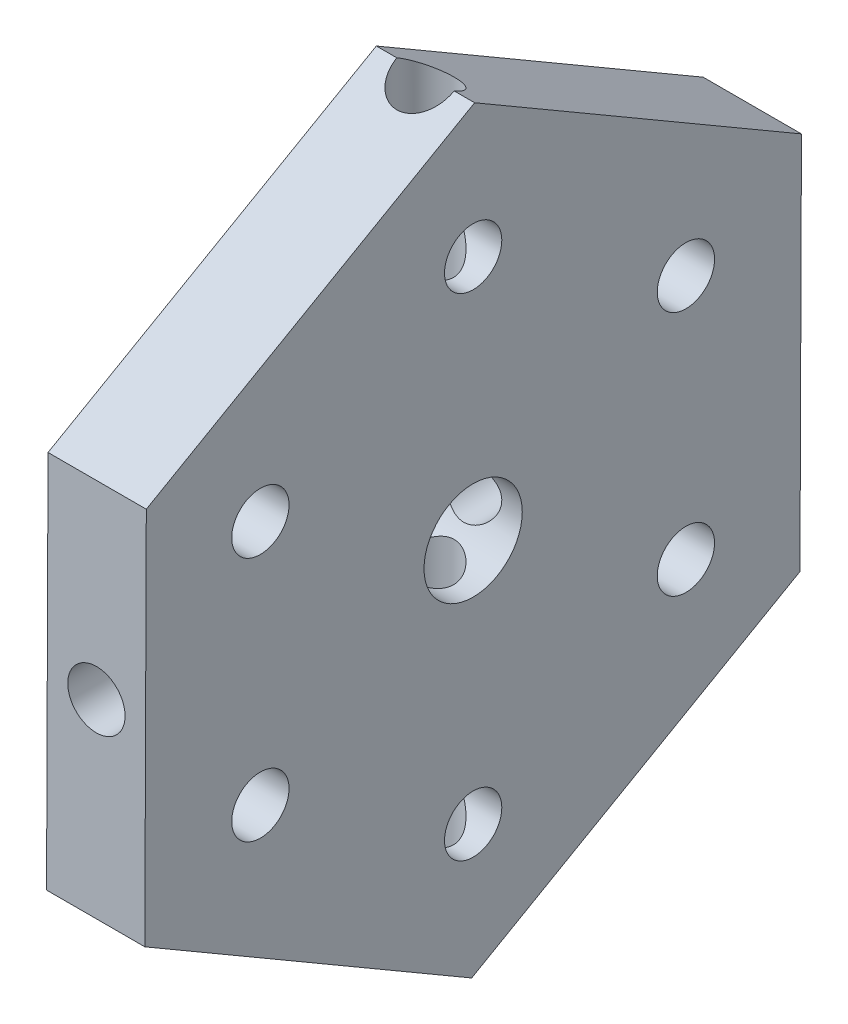
from build123d import *
from build123d.topology import SkipClean

# Parameters (mm, degrees)
ESQUISSE1_R                  = 3
ESQUISSE1_R_2                = 1.75
BOSS_EXTRU_1_DEPTH           = 6
BOSS_EXTRU_2_START           = 6
ESQUISSE2_R                  = 10
ESQUISSE2_R_2                = 3
BOSS_EXTRU_2_DEPTH           = 6
ENL_V_MAT_EXTRU_1_DEPTH      = 32.163011471
ENL_V_MAT_EXTRU_1_DEPTH_BACK = 32.163011471
ESQUISSE3_R                  = 1.75
ESQUISSE4_R                  = 1.75
ENL_V_MAT_EXTRU_2_DEPTH      = 47.653593371


with BuildPart() as part:
    # Esquisse1 → Boss.-Extru.1 (new body)
    with BuildSketch(Plane(origin=(0, 0, 0), x_dir=(0, 0, -1), z_dir=(1, 0, 0))):
        Polygon((-20.045153068, -11.468442431), (-0.090614047, -23.093832996), (19.954539021, -11.625390564), (20.045153068, 11.468442431), (0.090614047, 23.093832996), (-19.954539021, 11.625390564), align=None)
        Circle(ESQUISSE1_R, mode=Mode.SUBTRACT)
        with Locations((0, 15)):
            Circle(ESQUISSE1_R_2, mode=Mode.SUBTRACT)
        with Locations((12.990381057, 7.5)):
            Circle(ESQUISSE1_R_2, mode=Mode.SUBTRACT)
        with Locations((12.990381057, -7.5)):
            Circle(ESQUISSE1_R_2, mode=Mode.SUBTRACT)
        with Locations((0, -15)):
            Circle(ESQUISSE1_R_2, mode=Mode.SUBTRACT)
        with Locations((-12.990381057, -7.5)):
            Circle(ESQUISSE1_R_2, mode=Mode.SUBTRACT)
        with Locations((-12.990381057, 7.5)):
            Circle(ESQUISSE1_R_2, mode=Mode.SUBTRACT)
    extrude(amount=BOSS_EXTRU_1_DEPTH)

    # Esquisse2 → Boss.-Extru.2 (add)
    with SkipClean():  # the faces are left unmerged after this step: merging them gives an invalid solid
        with BuildSketch(Plane.ZY.offset(BOSS_EXTRU_2_START)):
            with Locations(Location((0, 0, 0), (0, 0, 180))):
                Circle(ESQUISSE2_R)
            Circle(ESQUISSE2_R_2, mode=Mode.SUBTRACT)
        extrude(amount=-BOSS_EXTRU_2_DEPTH)

    # Esquisse3 → Enlèv. mat.-Extru.1 (cut, two sides: drawn at the far end of the back side and taken through both)
    with SkipClean():  # the faces are left unmerged after this step: merging them gives an invalid solid
        with BuildSketch(Plane(origin=(0, 0, 0), x_dir=(1, 0, 0), z_dir=(0, 1, 0)).offset(-ENL_V_MAT_EXTRU_1_DEPTH_BACK)):
            with Locations(Location((-3, 0, 0), (0, 0, 270))):
                Circle(ESQUISSE3_R)
            with Locations(Location((3, 0.090614047, 0), (0, 0, 270))):
                Circle(ESQUISSE3_R)
        extrude(amount=ENL_V_MAT_EXTRU_1_DEPTH + ENL_V_MAT_EXTRU_1_DEPTH_BACK, mode=Mode.SUBTRACT)

    # Esquisse4 → Enlèv. mat.-Extru.2 (cut, through all)
    with SkipClean():  # the faces are left unmerged after this step: merging them gives an invalid solid
        with BuildSketch(Plane(origin=(0, 0.078474067, 19.999846045), x_dir=(1, 0, 0), z_dir=(0, 0.003923703326224442, 0.9999923022464763))):
            with Locations(Location((3, 0, 0), (0, 0, 270))):
                Circle(ESQUISSE4_R)
            with Locations(Location((-3, 0, 0), (0, 0, 270))):
                Circle(ESQUISSE4_R)
        extrude(amount=-ENL_V_MAT_EXTRU_2_DEPTH, mode=Mode.SUBTRACT)


solid = part.part
